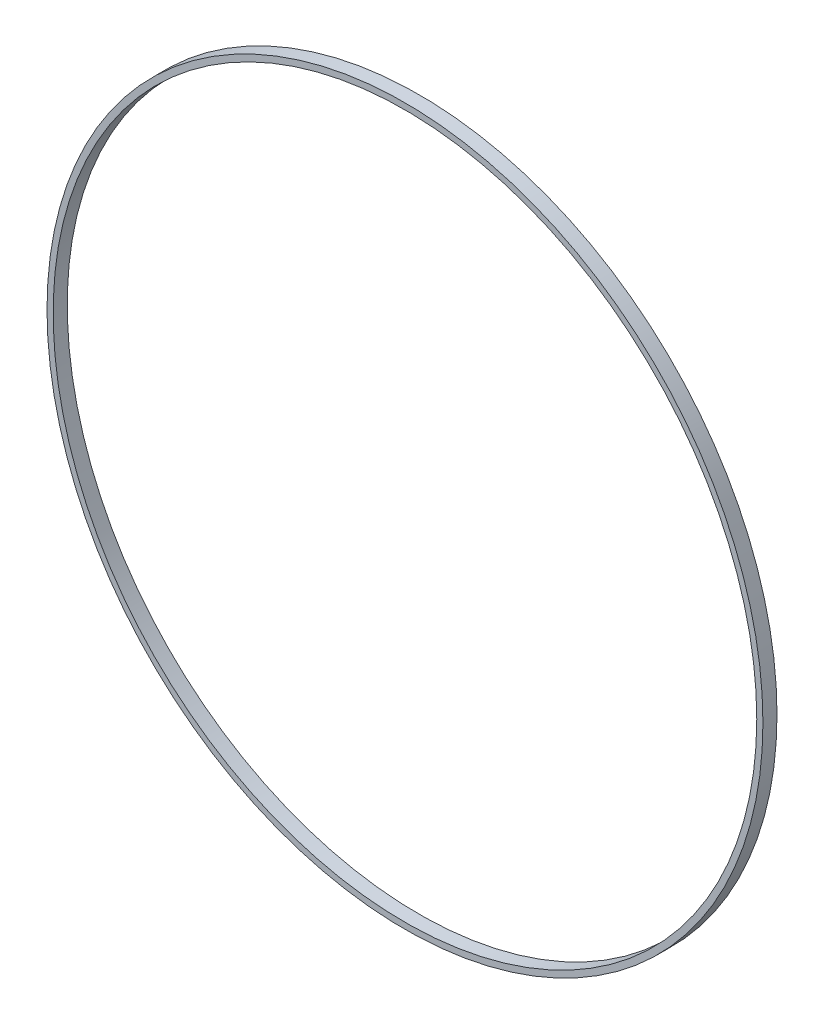
from build123d import *

# Parameters (mm, degrees)
ESQUISSE1_R        = 20.35
ESQUISSE1_R_2      = 20
BOSS_EXTRU_1_DEPTH = 0.8


with BuildPart() as part:
    # Esquisse1 → Boss.-Extru.1 (new body)
    with BuildSketch(Plane.XY):
        Circle(ESQUISSE1_R)
        Circle(ESQUISSE1_R_2, mode=Mode.SUBTRACT)
    extrude(amount=BOSS_EXTRU_1_DEPTH)


solid = part.part
